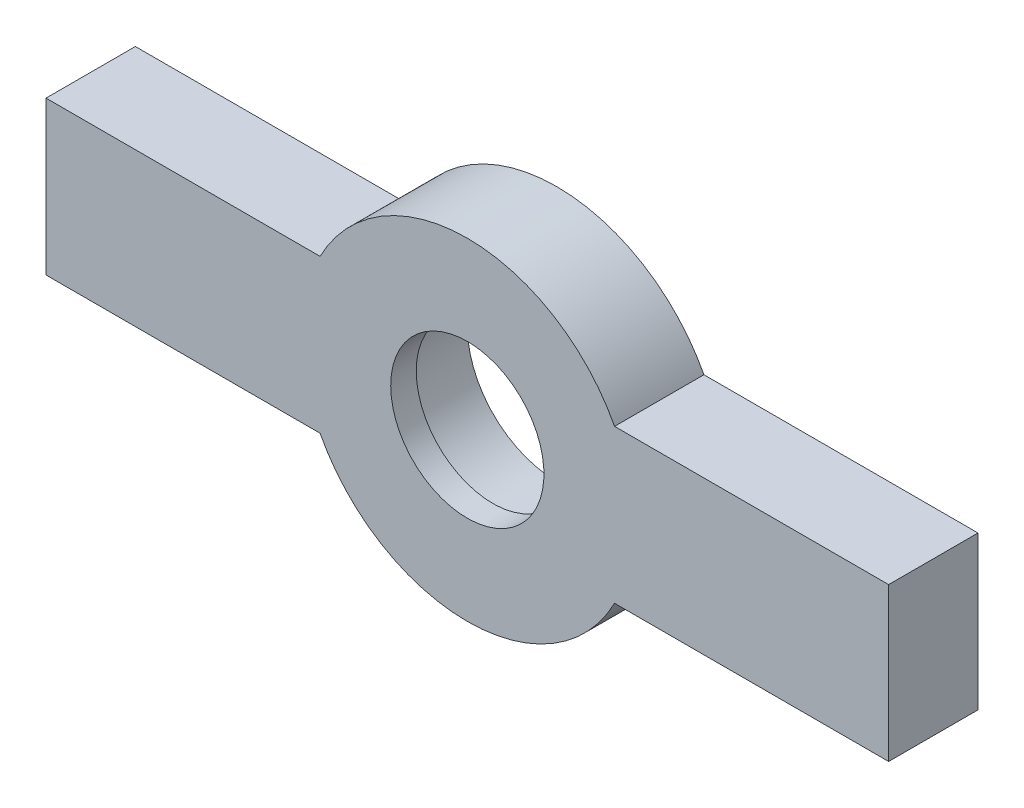
from build123d import *

# Parameters (mm, degrees)
RESSALTO_EXTRUS_O1_DEPTH = 35
ESBO_O2_R                = 35
CORTE_EXTRUS_O1_DEPTH    = 25
ESBO_O3_R                = 30
CORTE_EXTRUS_O2_DEPTH    = 477.313972081


with BuildPart() as part:
    # Esboço1 → Ressalto-extrusão1 (new body)
    with BuildSketch(Plane.XY):
        with BuildLine():
            Line((-257.662812973, -210), (-365, -210))
            Line((-365, -210), (-365, -270))
            Line((-365, -270), (-257.662812973, -270))
            ThreePointArc((-257.662812973, -270), (-200, -305), (-142.337187027, -270))
            Line((-142.337187027, -270), (-35, -270))
            Line((-35, -270), (-35, -210))
            Line((-35, -210), (-142.337187027, -210))
            ThreePointArc((-142.337187027, -210), (-200, -175), (-257.662812973, -210))
        make_face()
    extrude(amount=-RESSALTO_EXTRUS_O1_DEPTH)

    # Esboço2 → Corte-extrusão1 (cut)
    with BuildSketch(Plane(origin=(0, 0, -35), x_dir=(-1, 0, 0), z_dir=(0, 0, -1))):
        with Locations((200, -240)):
            Circle(ESBO_O2_R)
    extrude(amount=-CORTE_EXTRUS_O1_DEPTH, mode=Mode.SUBTRACT)

    # Esboço3 → Corte-extrusão2 (cut, through all)
    with BuildSketch(Plane(origin=(0, 0, -10), x_dir=(-1, 0, 0), z_dir=(0, 0, -1))):
        with Locations((200, -240)):
            Circle(ESBO_O3_R)
    extrude(amount=-CORTE_EXTRUS_O2_DEPTH, mode=Mode.SUBTRACT)


solid = part.part
